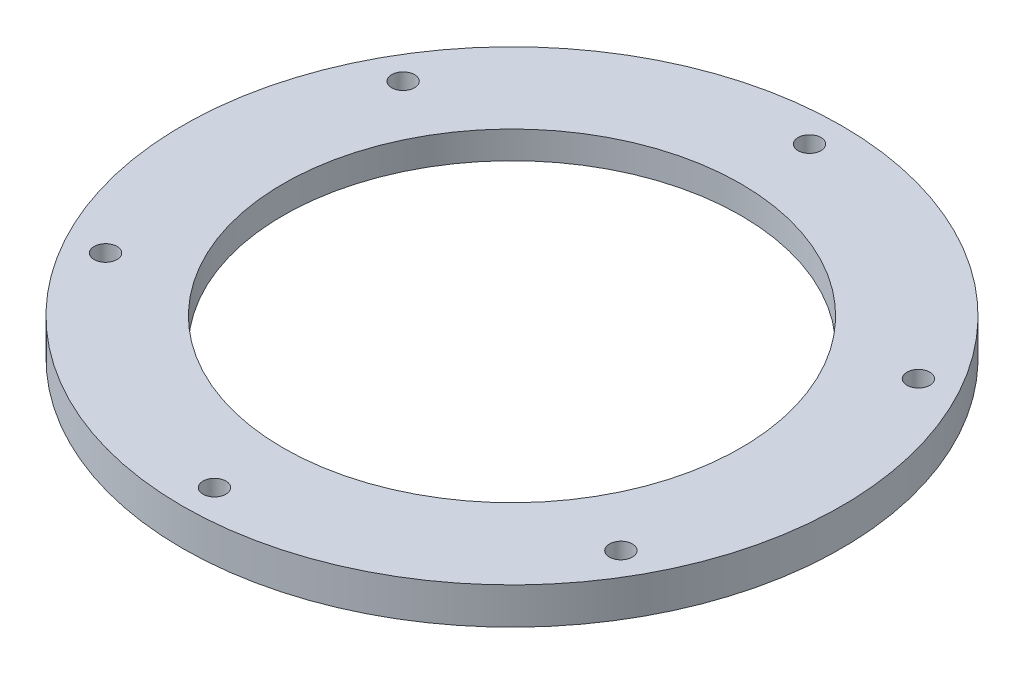
from build123d import *

# Parameters (mm, degrees)
SKETCH_1_R           = 36
SKETCH_1_R_2         = 25
EXTRUDE_1_DEPTH      = 3
EXTRUDE_START        = 1
SKETCH_3_R           = 36
SKETCH_3_R_2         = 35
EXTRUDE_2_DEPTH      = 1
HOLE_WIZARD_M2_5_1_D = 2.5


with BuildPart() as part:
    # 草图1 → 凸台-拉伸1 (new body)
    with BuildSketch(Plane(origin=(0, 0, 0), x_dir=(1, 0, 0), z_dir=(0, 1, 0))):
        with Locations(Location((0, 0, 0), (0, 0, 270))):
            Circle(SKETCH_1_R)
        with Locations(Location((0, 0, 0), (0, 0, 270))):
            Circle(SKETCH_1_R_2, mode=Mode.SUBTRACT)
    extrude(amount=EXTRUDE_1_DEPTH)

    # 草图3 → 凸台-拉伸2 (add)
    with BuildSketch(Plane.XZ.offset(EXTRUDE_START)):
        with Locations(Location((0, 0, 0), (0, 0, 270))):
            Circle(SKETCH_3_R)
        with Locations(Location((0, 0, 0), (0, 0, 270))):
            Circle(SKETCH_3_R_2, mode=Mode.SUBTRACT)
    extrude(amount=-EXTRUDE_2_DEPTH)

    # M2.5 螺纹孔1 (through all)
    with Locations(Plane(origin=(0, 0, 32.5), x_dir=(0, 0, -1), z_dir=(0, -1, 0))):
        with Locations((0, 0), (16.25, 28.145825623), (48.75, 28.145825623), (16.25, -28.145825623), (48.75, -28.145825623), (65, 0)):
            Hole(HOLE_WIZARD_M2_5_1_D / 2)


solid = part.part
